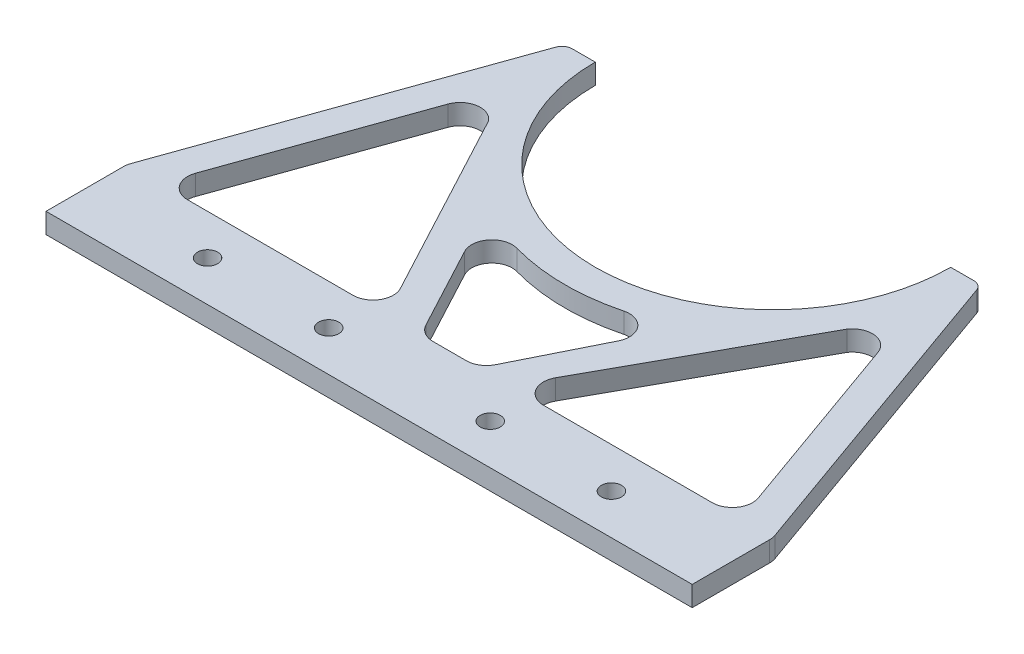
from build123d import *

# Parameters (mm, degrees)
SKETCH1_R           = 3.175
BOSS_EXTRUDE1_DEPTH = 6.35
FILLET1_R           = 3.175


with BuildPart() as part:
    # Sketch1 → Boss-Extrude1 (new body)
    with BuildSketch(Plane(origin=(0, 0, 0), x_dir=(1, 0, 0), z_dir=(0, 1, 0))):
        with BuildLine():
            ThreePointArc((55.88, 63.5), (0, 7.62), (-55.88, 63.5))
            Line((-55.88, 63.5), (-65.405, 63.5))
            Line((-65.405, 63.5), (-101.231750934, -37.066318412))
            ThreePointArc((-101.231750934, -37.066318412), (-101.50726052, -38.116025925), (-101.6, -39.197317183))
            Line((-101.6, -39.197317183), (-101.6, -63.5))
            Line((-101.6, -63.5), (101.6, -63.5))
            Line((101.6, -63.5), (101.6, -39.197317183))
            ThreePointArc((101.6, -39.197317183), (101.50726052, -38.116025925), (101.231750934, -37.066318412))
            Line((101.231750934, -37.066318412), (65.405, 63.5))
            Line((65.405, 63.5), (55.88, 63.5))
        make_face()
        with Locations(Location((-63.5, -50.8, 0), (0, 0, 270))):
            Circle(SKETCH1_R, mode=Mode.SUBTRACT)
        with Locations(Location((-25.4, -50.8, 0), (0, 0, 270))):
            Circle(SKETCH1_R, mode=Mode.SUBTRACT)
        with BuildLine():
            Line((-30.492459165, -38.1), (-82.485514384, -38.1))
            ThreePointArc((-82.485514384, -38.1), (-87.67465411, -35.409962965), (-88.467265319, -29.61900123))
            Line((-88.467265319, -29.61900123), (-67.620951247, 28.896968093))
            ThreePointArc((-67.620951247, 28.896968093), (-62.60882158, 33.04150393), (-56.579551543, 30.602954379))
            Line((-56.579551543, 30.602954379), (-24.890648803, -28.759645393))
            ThreePointArc((-24.890648803, -28.759645393), (-25.046761241, -35.016018084), (-30.492459165, -38.1))
        make_face(mode=Mode.SUBTRACT)
        with BuildLine():
            ThreePointArc((-5.299041163, -38.1), (-8.565059247, -37.195697924), (-10.900851525, -34.740354607))
            Line((-10.900851525, -34.740354607), (-24.84623891, -8.616557995))
            ThreePointArc((-24.84623891, -8.616557995), (-24.197984845, -1.653196967), (-17.541381774, 0.491159744))
            ThreePointArc((-17.541381774, 0.491159744), (-0.588821605, -1.902349454), (16.404084946, 0.185546499))
            ThreePointArc((16.404084946, 0.185546499), (22.928583423, -1.961591642), (23.68255589, -8.788802499))
            Line((23.68255589, -8.788802499), (10.859081809, -34.577314678))
            ThreePointArc((10.859081809, -34.577314678), (8.517567892, -37.14796018), (5.173240471, -38.1))
            Line((5.173240471, -38.1), (-5.299041163, -38.1))
        make_face(mode=Mode.SUBTRACT)
        with Locations(Location((25.4, -50.8, 0), (0, 0, 270))):
            Circle(SKETCH1_R, mode=Mode.SUBTRACT)
        with Locations(Location((63.5, -50.8, 0), (0, 0, 270))):
            Circle(SKETCH1_R, mode=Mode.SUBTRACT)
        with BuildLine():
            Line((67.620951247, 28.896968093), (88.467265319, -29.61900123))
            ThreePointArc((88.467265319, -29.61900123), (87.67465411, -35.409962965), (82.485514384, -38.1))
            Line((82.485514384, -38.1), (29.423726477, -38.1))
            ThreePointArc((29.423726477, -38.1), (23.956198754, -34.979340583), (23.862621229, -28.684611212))
            Line((23.862621229, -28.684611212), (56.428690976, 30.395444829))
            ThreePointArc((56.428690976, 30.395444829), (62.481851802, 33.059810636), (67.620951247, 28.896968093))
        make_face(mode=Mode.SUBTRACT)
    extrude(amount=BOSS_EXTRUDE1_DEPTH)

    # Fillet1
    fillet1_edges = [part.edges().sort_by_distance(p)[0] for p in [
        (-65.405, 3.175, -63.5),
        (65.405, 3.175, -63.5),
    ]]
    fillet(fillet1_edges, radius=FILLET1_R)


solid = part.part
